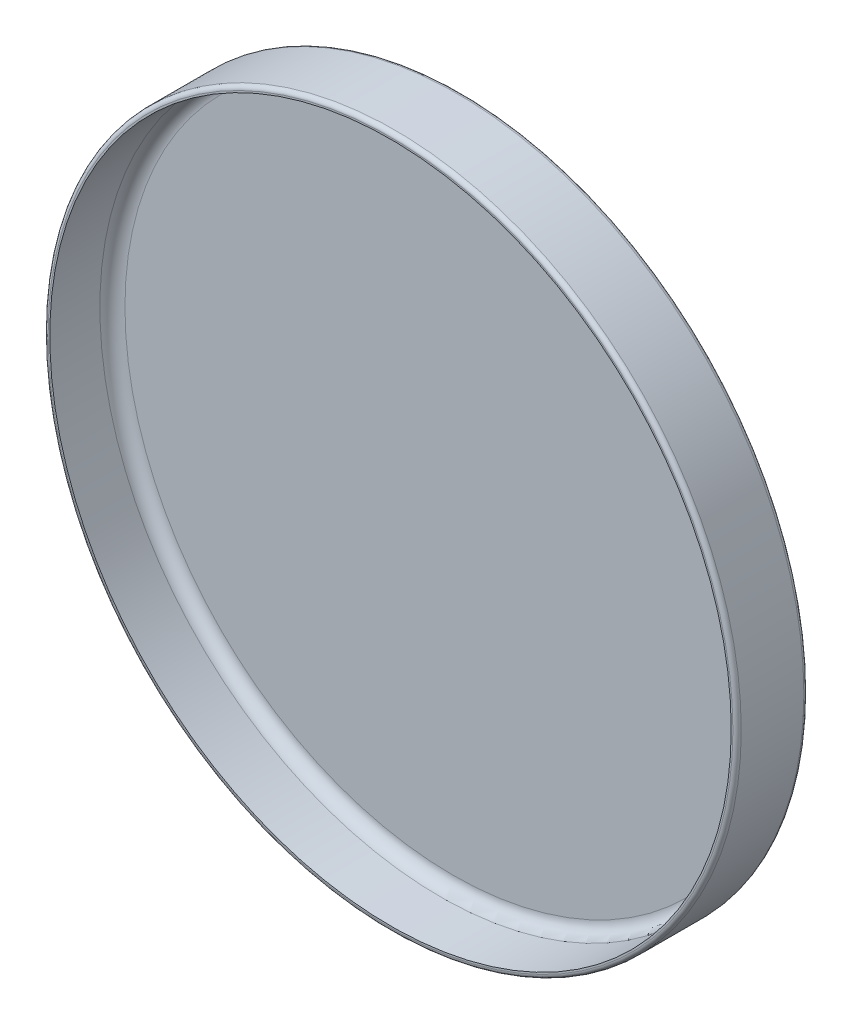
from build123d import *

# Parameters (mm, degrees)
SKETCH1_R           = 83
BOSS_EXTRUDE1_DEPTH = 2
BOSS_EXTRUDE2_START = 15
SKETCH1_3_R         = 83
SKETCH1_3_R_2       = 81.6
BOSS_EXTRUDE2_DEPTH = 15
FILLET3_R           = 1
FILLET4_R           = 1
FILLET5_R           = 3


with BuildPart() as part:
    # Sketch1 → Boss-Extrude1 (new body)
    with BuildSketch(Plane.XY):
        Circle(SKETCH1_R)
    extrude(amount=-BOSS_EXTRUDE1_DEPTH)

    # Sketch1<3> → Boss-Extrude2 (add)
    with BuildSketch(Plane.XY.offset(BOSS_EXTRUDE2_START)):
        Circle(SKETCH1_3_R)
        Circle(SKETCH1_3_R_2, mode=Mode.SUBTRACT)
    extrude(amount=-BOSS_EXTRUDE2_DEPTH)

    # Fillet3
    fillet3_edges = [part.edges().sort_by_distance(p)[0] for p in [
        (-83, 0, -2),
    ]]
    fillet(fillet3_edges, radius=FILLET3_R)

    # Fillet4
    fillet4_edges = [part.edges().sort_by_distance(p)[0] for p in [
        (-83, 0, 15),
    ]]
    fillet(fillet4_edges, radius=FILLET4_R)

    # Fillet5
    fillet5_edges = [part.edges().sort_by_distance(p)[0] for p in [
        (-81.6, 0, 0),
    ]]
    fillet(fillet5_edges, radius=FILLET5_R)


solid = part.part
